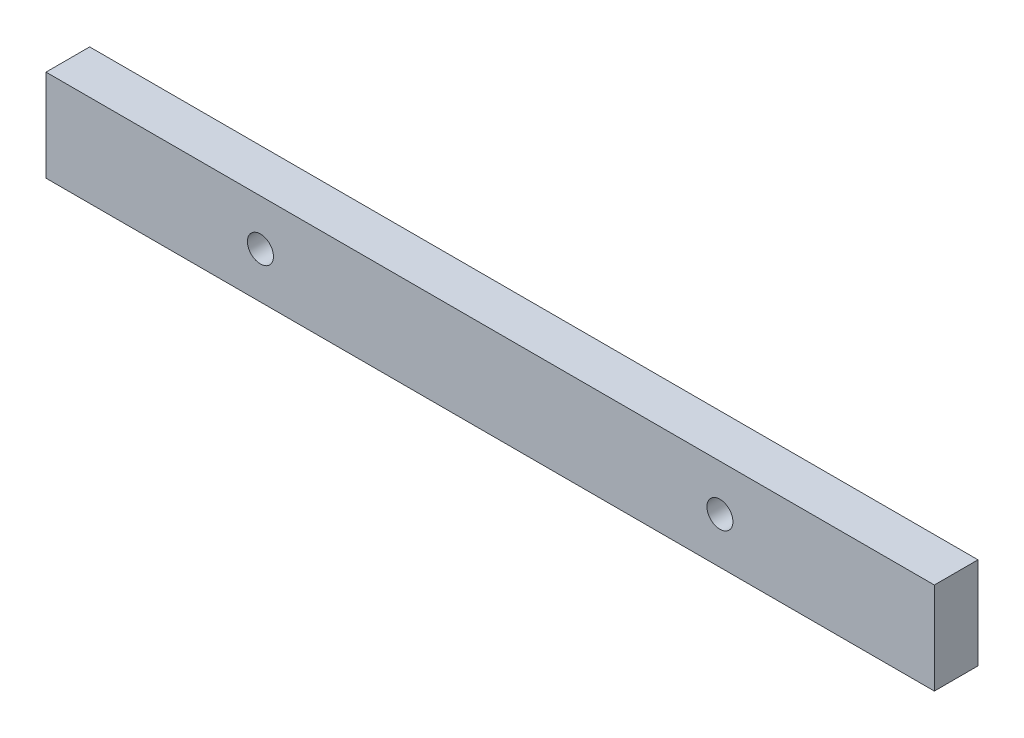
from build123d import *

# Parameters (mm, degrees)
SKETCH1_W           = 58
SKETCH1_H           = 6
BOSS_EXTRUDE1_DEPTH = 2.85
SKETCH2_R           = 0.849442743
CUT_EXTRUDE1_DEPTH  = 30.293727998


with BuildPart() as part:
    # Sketch1 → Boss-Extrude1 (new body)
    with BuildSketch(Plane.XY):
        Rectangle(SKETCH1_W, SKETCH1_H)
    extrude(amount=BOSS_EXTRUDE1_DEPTH)

    # Sketch2 → Cut-Extrude1 (cut, through all)
    with BuildSketch(Plane.XY.offset(2.85)):
        with Locations((15, 0)):
            Circle(SKETCH2_R)
        with Locations((-15, 0)):
            Circle(SKETCH2_R)
    extrude(amount=-CUT_EXTRUDE1_DEPTH, mode=Mode.SUBTRACT)


solid = part.part
